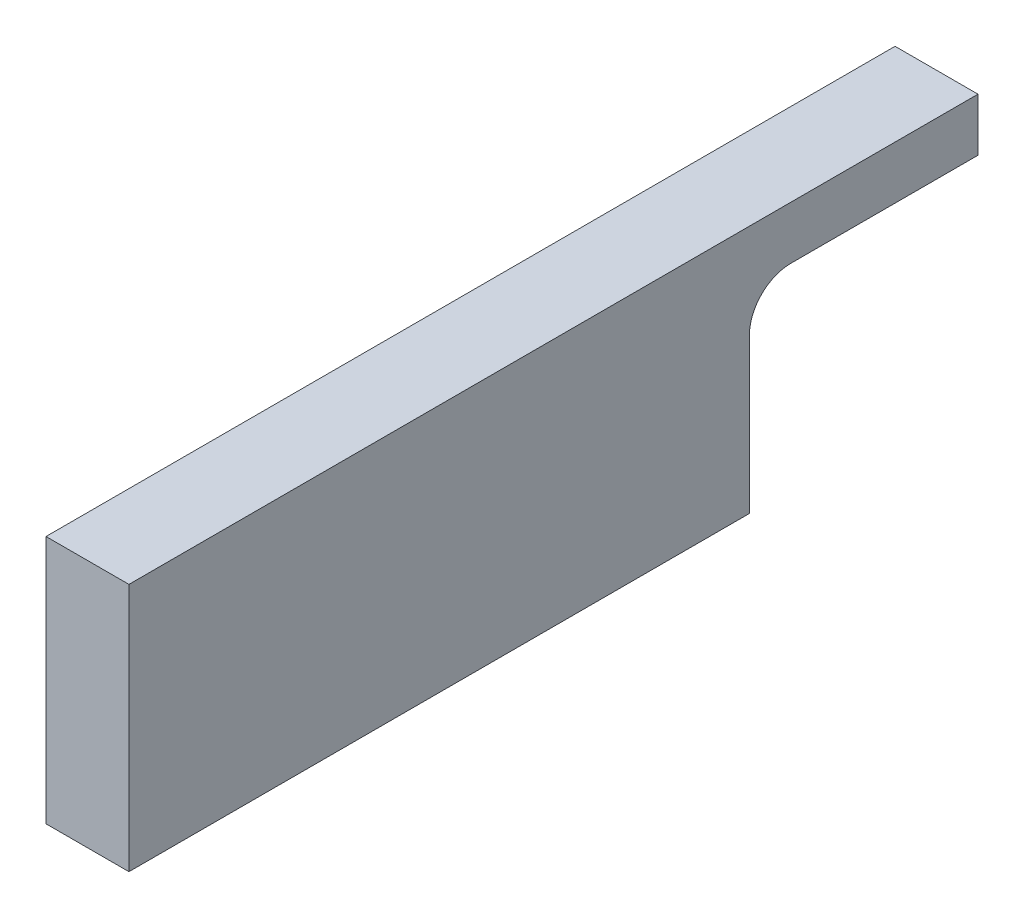
from build123d import *

# Parameters (mm, degrees)
BOSS_EXTRUDE1_DEPTH = 12.7


with BuildPart() as part:
    # Sketch2 → Boss-Extrude1 (new, symmetric)
    with BuildSketch(Plane(origin=(0, 0, 0), x_dir=(0, 0, -1), z_dir=(1, 0, 0))):
        with BuildLine():
            Line((-130, 38.1), (130, 38.1))
            Line((130, 38.1), (130, 21.9))
            Line((130, 21.9), (72.7, 21.9))
            ThreePointArc((72.7, 21.9), (63.719743879, 18.180256121), (60, 9.2))
            Line((60, 9.2), (60, -38.1))
            Line((60, -38.1), (-130, -38.1))
            Line((-130, -38.1), (-130, 38.1))
        make_face()
    extrude(amount=BOSS_EXTRUDE1_DEPTH, both=True)


solid = part.part
